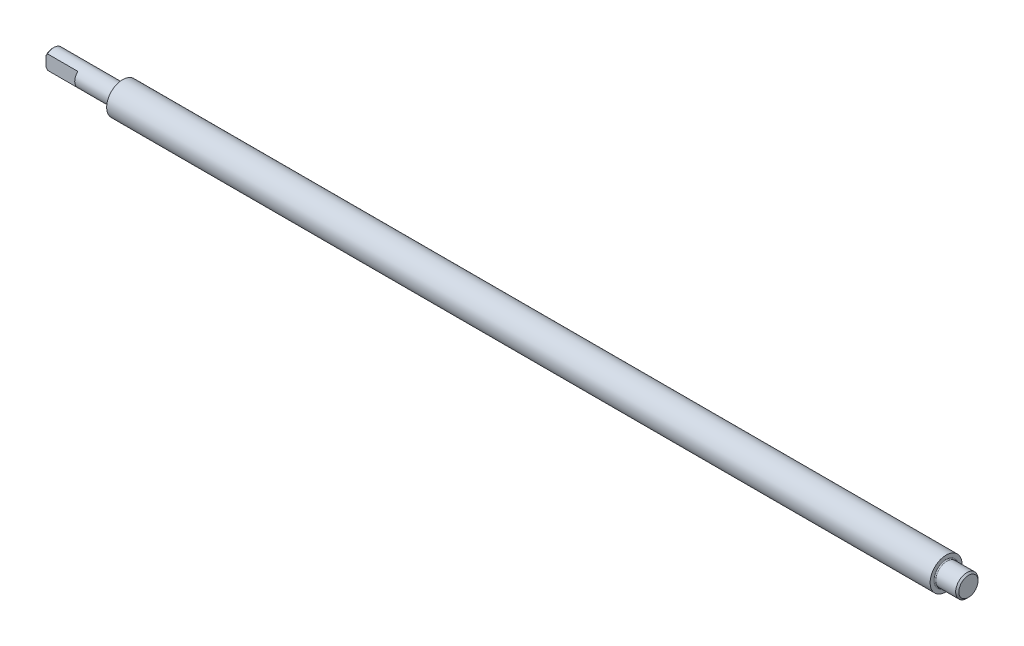
from build123d import *

# Parameters (mm, degrees)
SKETCH1_W           = 258
SKETCH1_H           = 5
SKETCH2_R           = 3
BOSS_EXTRUDE1_DEPTH = 22
CUT_EXTRUDE1_START  = -10
CUT_EXTRUDE1_DEPTH  = 10
SKETCH4_R           = 3.5
BOSS_EXTRUDE2_DEPTH = 7
CHAMFER1_SIZE       = 0.5
FILLET1_R           = 0.3


with BuildPart() as part:
    # Sketch1 → Revolve1 (revolve)
    with BuildSketch(Plane.XY, mode=Mode.PRIVATE) as revolve1_sk:
        with Locations((151, 2.5)):
            Rectangle(SKETCH1_W, SKETCH1_H)
    revolve(revolve1_sk.sketch.rotate(Axis((22, 0, 0), (1, 0, 0)), 270), axis=Axis((22, 0, 0), (1, 0, 0)))

    # Sketch2 → Boss-Extrude1 (add)
    with BuildSketch(Plane.ZY.offset(-22)):
        Circle(SKETCH2_R)
    extrude(amount=BOSS_EXTRUDE1_DEPTH)

    # Sketch3 → Cut-Extrude1 (cut)
    with BuildSketch(Plane.ZY.offset(CUT_EXTRUDE1_START)):
        with BuildLine():
            Line((2, 2.236067977), (2, -2.236067977))
            ThreePointArc((2, -2.236067977), (3, 0), (2, 2.236067977))
        make_face()
    extrude(amount=CUT_EXTRUDE1_DEPTH, mode=Mode.SUBTRACT)

    # Sketch4 → Boss-Extrude2 (add)
    with BuildSketch(Plane(origin=(280, 0, 0), x_dir=(0, 0, -1), z_dir=(1, 0, 0))):
        with Locations(Location((0, 0, 0), (0, 0, 180))):
            Circle(SKETCH4_R)
    extrude(amount=BOSS_EXTRUDE2_DEPTH)

    # Chamfer1
    chamfer1_edges = [part.edges().sort_by_distance(p)[0] for p in [
        (287, 0, -3.5),
        (0, 0, -3),
    ]]
    chamfer(chamfer1_edges, length=CHAMFER1_SIZE)

    # Fillet1
    fillet1_edges = [part.edges().sort_by_distance(p)[0] for p in [
        (280, 0, -3.5),
        (22, 0, -3),
    ]]
    fillet(fillet1_edges, radius=FILLET1_R)


solid = part.part
